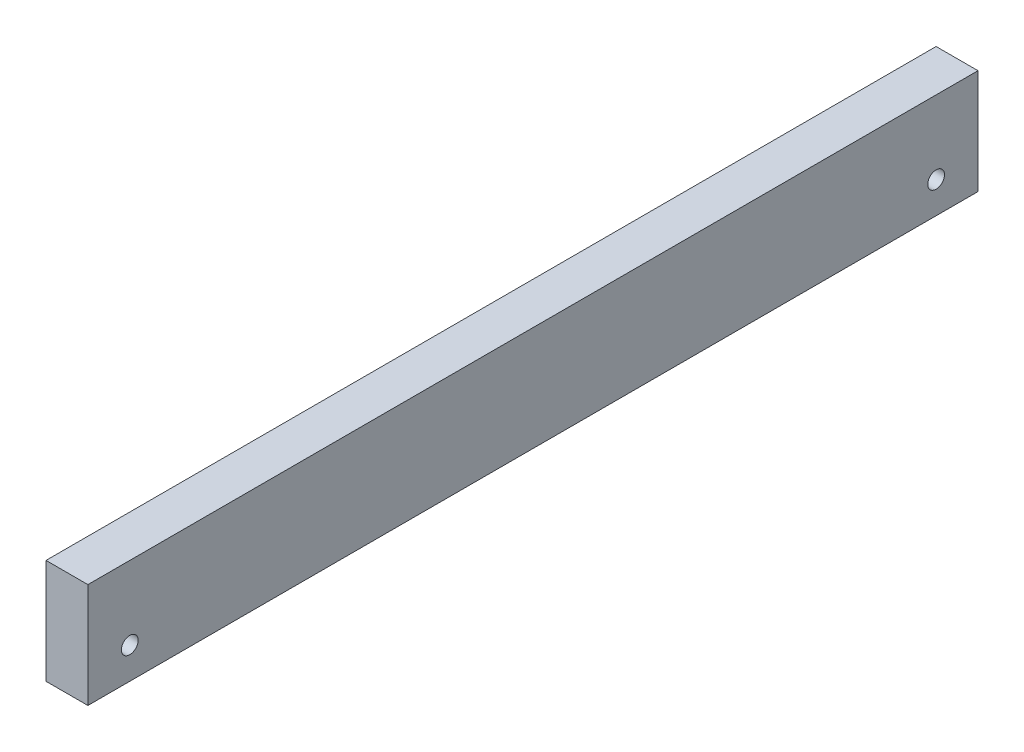
from build123d import *

# Parameters (mm, degrees)
SKETCH1_W                = 20
SKETCH1_H                = 50
EXTRUDE1_DEPTH           = 425
F_8_0_8_DIAMETER_HOLE1_D = 8


with BuildPart() as part:
    # Sketch1 → Extrude1 (new body)
    with BuildSketch(Plane.XY):
        with Locations((10, 25)):
            Rectangle(SKETCH1_W, SKETCH1_H)
    extrude(amount=EXTRUDE1_DEPTH)

    # Ø8.0 (8) Diameter Hole1 (through all)
    with Locations(Plane(origin=(20, 15, 405), x_dir=(0, 0, 1), z_dir=(1, 0, 0))):
        with Locations((0, 0), (-385, 0)):
            Hole(F_8_0_8_DIAMETER_HOLE1_D / 2)


solid = part.part
